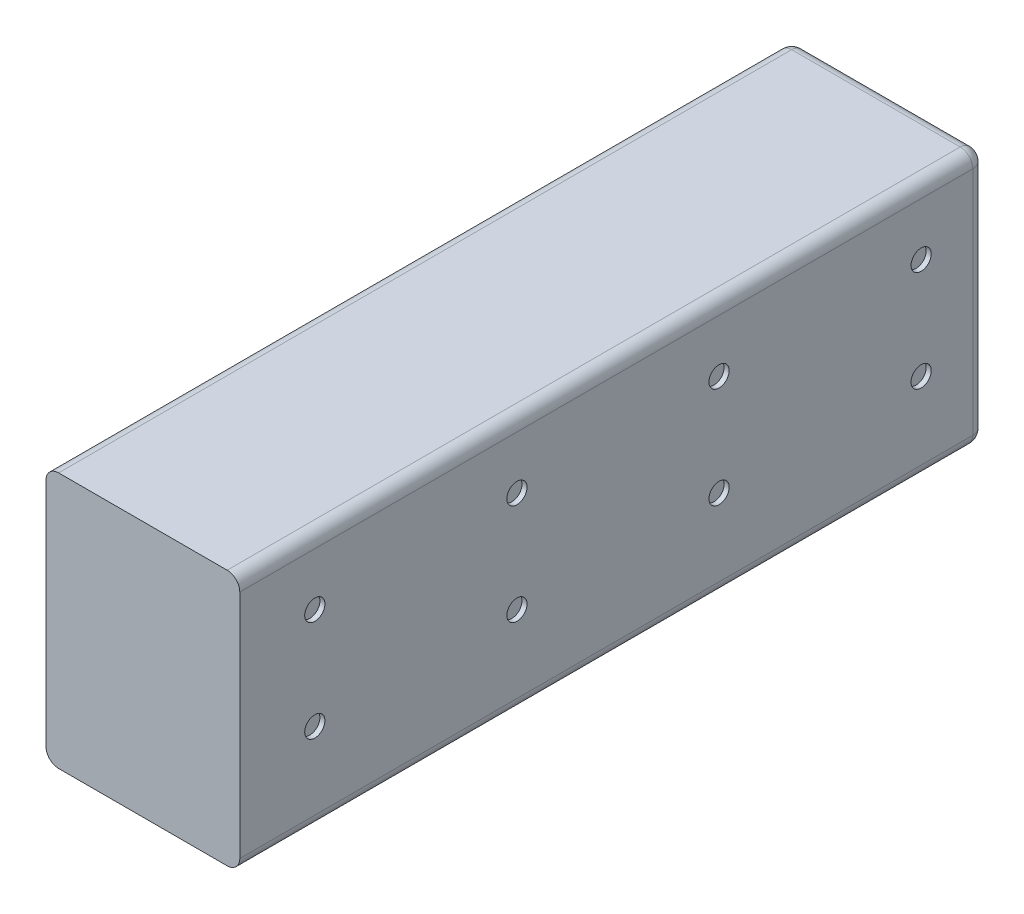
from build123d import *

# Parameters (mm, degrees)
SKETCH2_W           = 76.708
SKETCH2_H           = 101.346
BOSS_EXTRUDE1_DEPTH = 295.148
SKETCH3_R           = 4
CUT_EXTRUDE1_DEPTH  = 2
FILLET1_R           = 5
FILLET2_R           = 5


with BuildPart() as part:
    # Sketch2 → Boss-Extrude1 (new body)
    with BuildSketch(Plane.XY):
        with Locations((38.354, 50.673)):
            Rectangle(SKETCH2_W, SKETCH2_H)
    extrude(amount=BOSS_EXTRUDE1_DEPTH)

    # Sketch3 → Cut-Extrude1 (cut)
    with BuildSketch(Plane(origin=(76.708, 0, 0), x_dir=(0, 0, -1), z_dir=(1, 0, 0))):
        with Locations((-265.445597479, 75.450765932)):
            Circle(SKETCH3_R)
        with Locations((-185.445597479, 75.450765932)):
            Circle(SKETCH3_R)
        with Locations((-105.445597479, 75.450765932)):
            Circle(SKETCH3_R)
        with Locations((-25.445597479, 75.450765932)):
            Circle(SKETCH3_R)
        with Locations((-185.445597479, 35.450765932)):
            Circle(SKETCH3_R)
        with Locations((-105.445597479, 35.450765932)):
            Circle(SKETCH3_R)
        with Locations((-25.445597479, 35.450765932)):
            Circle(SKETCH3_R)
        with Locations((-265.445597479, 35.450765932)):
            Circle(SKETCH3_R)
    cut_extrude1 = extrude(amount=-CUT_EXTRUDE1_DEPTH, mode=Mode.SUBTRACT)

    # Mirror1: Cut-Extrude1 across plane
    add(cut_extrude1.mirror(Plane.ZY.offset(-38.354)), mode=Mode.SUBTRACT)

    # Fillet1
    fillet1_edges = [part.edges().sort_by_distance(p)[0] for p in [
        (0, 101.346, 147.574),
        (76.708, 101.346, 147.574),
        (76.708, 0, 147.574),
        (0, 0, 147.574),
    ]]
    fillet(fillet1_edges, radius=FILLET1_R)

    # Fillet2
    fillet2_edges = [part.edges().sort_by_distance(p)[0] for p in [
        (38.354, 0, 0),
        (0, 50.673, 0),
        (38.354, 101.346, 0),
        (76.708, 50.673, 0),
        (1.464466094, 99.881533906, 0),
        (75.243533906, 99.881533906, 0),
        (75.243533906, 1.464466094, 0),
        (1.464466094, 1.464466094, 0),
    ]]
    fillet(fillet2_edges, radius=FILLET2_R)


solid = part.part
